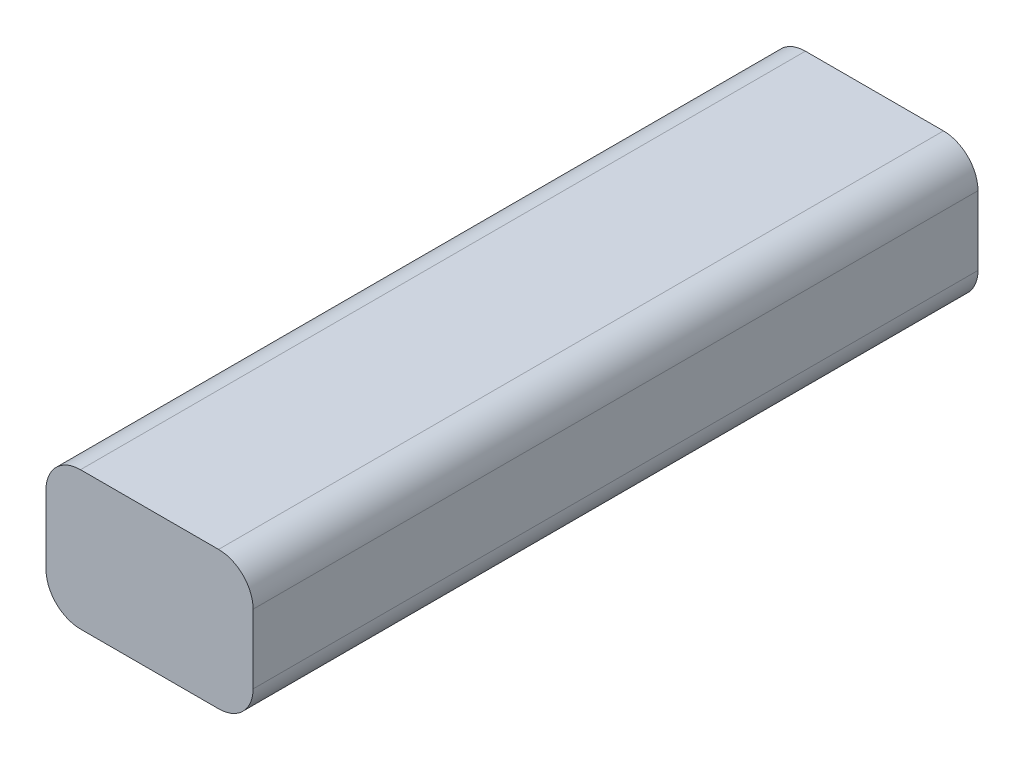
from build123d import *

# Parameters (mm, degrees)
SKETCH1_W           = 30
SKETCH1_H           = 105
BOSS_EXTRUDE1_DEPTH = 20
FILLET1_R           = 5


with BuildPart() as part:
    # Sketch1 → Boss-Extrude1 (new body)
    with BuildSketch(Plane(origin=(0, 0, 0), x_dir=(1, 0, 0), z_dir=(0, 1, 0))):
        with Locations((635.448656909, 668.249868459)):
            Rectangle(SKETCH1_W, SKETCH1_H)
    extrude(amount=BOSS_EXTRUDE1_DEPTH)

    # Fillet1
    fillet1_edges = [part.edges().sort_by_distance(p)[0] for p in [
        (620.448656909, 20, -668.249868459),
        (650.448656909, 20, -668.249868459),
        (620.448656909, 0, -668.249868459),
        (650.448656909, 0, -668.249868459),
    ]]
    fillet(fillet1_edges, radius=FILLET1_R)


solid = part.part
